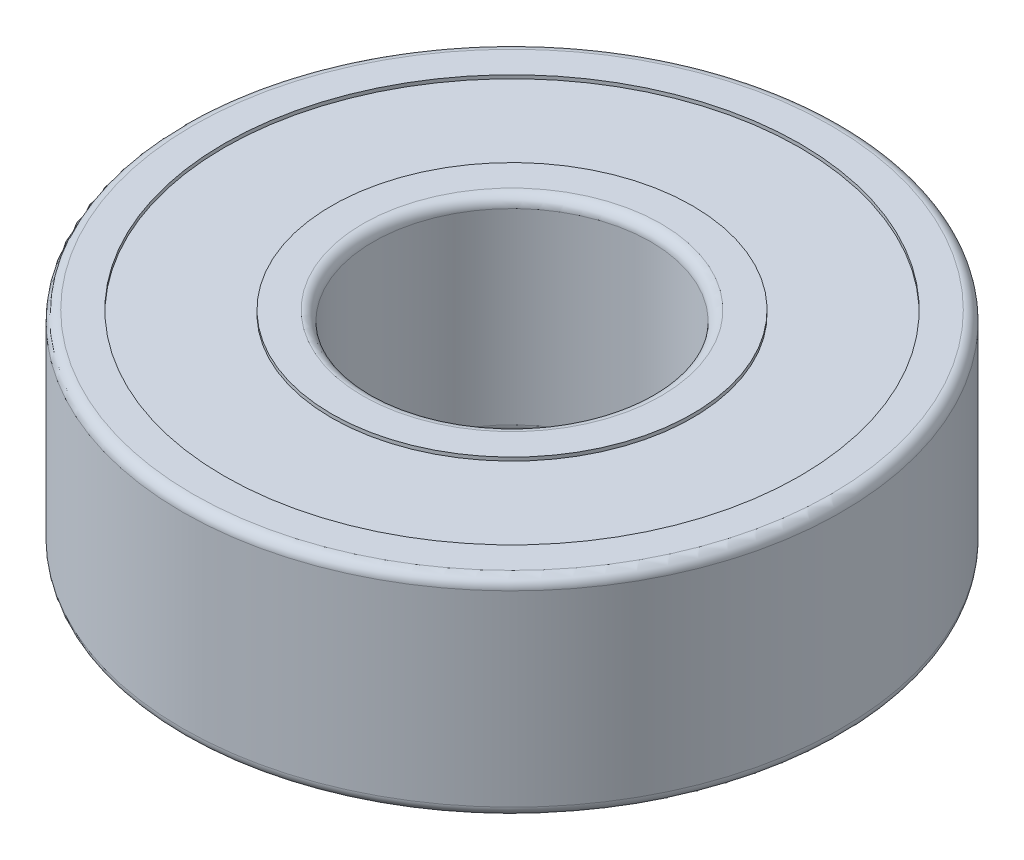
from build123d import *

# Parameters (mm, degrees)
CROQUIS1_R              = 9.5
CROQUIS1_R_2            = 4
SALIENTE_EXTRUIR1_DEPTH = 6
CROQUIS2_R              = 8.3
CROQUIS2_R_2            = 5.2
CORTAR_EXTRUIR1_DEPTH   = 0.1
REDONDEO1_R             = 0.3


with BuildPart() as part:
    # Croquis1 → Saliente-Extruir1 (new body)
    with BuildSketch(Plane(origin=(0, 0, 0), x_dir=(1, 0, 0), z_dir=(0, 1, 0))):
        with Locations(Location((0, 0, 0), (0, 0, 270))):
            Circle(CROQUIS1_R)
        with Locations(Location((0, 0, 0), (0, 0, 270))):
            Circle(CROQUIS1_R_2, mode=Mode.SUBTRACT)
    extrude(amount=SALIENTE_EXTRUIR1_DEPTH)

    # Croquis2 → Cortar-Extruir1 (cut)
    with BuildSketch(Plane(origin=(0, 6, 0), x_dir=(1, 0, 0), z_dir=(0, 1, 0))):
        with Locations(Location((0, 0, 0), (0, 0, 270))):
            Circle(CROQUIS2_R)
        with Locations(Location((0, 0, 0), (0, 0, 270))):
            Circle(CROQUIS2_R_2, mode=Mode.SUBTRACT)
    cortar_extruir1 = extrude(amount=-CORTAR_EXTRUIR1_DEPTH, mode=Mode.SUBTRACT)

    # Simetría1: Cortar-Extruir1 across plane
    add(cortar_extruir1.mirror(Plane.ZX.offset(3)), mode=Mode.SUBTRACT)

    # Redondeo1
    redondeo1_edges = [part.edges().sort_by_distance(p)[0] for p in [
        (0, 0, -9.5),
        (0, 6, -9.5),
        (0, 0, -4),
        (0, 6, -4),
    ]]
    fillet(redondeo1_edges, radius=REDONDEO1_R)


solid = part.part
